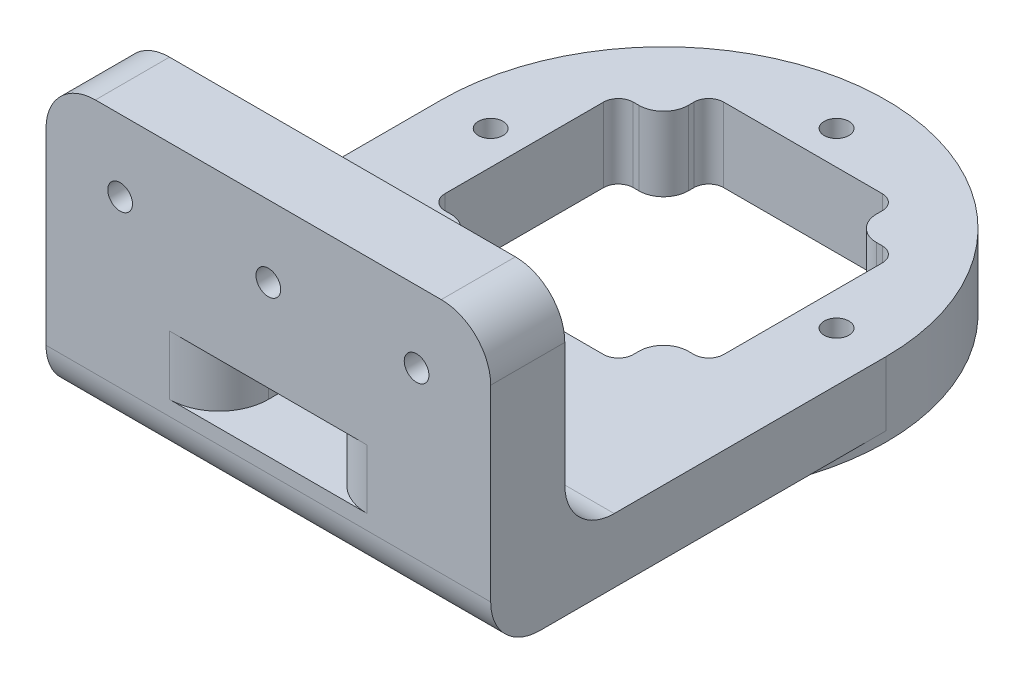
from build123d import *

# Parameters (mm, degrees)
BOSS_EXTRUDE1_DEPTH     = 15
SKETCH2_W               = 90
SKETCH2_H               = 15
BOSS_EXTRUDE2_DEPTH     = 45
CUT_EXTRUDE1_DEPTH      = 2
SKETCH4_R               = 2.5
CUT_EXTRUDE2_DEPTH      = 110.658560997
FILLET1_R               = 10
SKETCH5_R               = 2.5
CUT_EXTRUDE3_DEPTH      = 134.135269557
CUT_EXTRUDE4_DEPTH      = 103.225241501
CUT_EXTRUDE5_DEPTH      = 4
CUT_EXTRUDE6_DEPTH      = 10
CUT_EXTRUDE6_DEPTH_BACK = 15
SKETCH8_W               = 20
SKETCH8_H               = 12
FILLET2_R               = 10


with BuildPart() as part:
    # Sketch1 → Boss-Extrude1 (new body)
    with BuildSketch(Plane(origin=(0, 0, 0), x_dir=(1, 0, 0), z_dir=(0, 1, 0))):
        with BuildLine():
            ThreePointArc((45, 0), (0, -45), (-45, 0))
            Line((-45, 0), (-45, -80))
            Line((-45, -80), (45, -80))
            Line((45, -80), (45, 0))
        make_face()
        with BuildLine():
            Line((-28.2, -16.05), (-28.2, 0))
            Line((-28.2, 0), (-45, 0))
            ThreePointArc((-45, 0), (0, -45), (45, 0))
            Line((45, 0), (28.2, 0))
            Line((28.2, 0), (28.2, -16.05))
            ThreePointArc((28.2, -16.05), (27.321320344, -18.171320344), (25.2, -19.05))
            Line((25.2, -19.05), (24.05, -19.05))
            ThreePointArc((24.05, -19.05), (20.514466094, -20.514466094), (19.05, -24.05))
            Line((19.05, -24.05), (19.05, -25.2))
            ThreePointArc((19.05, -25.2), (18.171320344, -27.321320344), (16.05, -28.2))
            Line((16.05, -28.2), (-16.05, -28.2))
            ThreePointArc((-16.05, -28.2), (-18.171320344, -27.321320344), (-19.05, -25.2))
            Line((-19.05, -25.2), (-19.05, -24.05))
            ThreePointArc((-19.05, -24.05), (-20.514466094, -20.514466094), (-24.05, -19.05))
            Line((-24.05, -19.05), (-25.2, -19.05))
            ThreePointArc((-25.2, -19.05), (-27.321320344, -18.171320344), (-28.2, -16.05))
        make_face()
        with BuildLine():
            ThreePointArc((-19.05, 25.2), (-18.171320344, 27.321320344), (-16.05, 28.2))
            Line((-16.05, 28.2), (16.05, 28.2))
            ThreePointArc((16.05, 28.2), (18.171320344, 27.321320344), (19.05, 25.2))
            Line((19.05, 25.2), (19.05, 24.05))
            ThreePointArc((19.05, 24.05), (20.514466094, 20.514466094), (24.05, 19.05))
            Line((24.05, 19.05), (25.2, 19.05))
            ThreePointArc((25.2, 19.05), (27.321320344, 18.171320344), (28.2, 16.05))
            Line((28.2, 16.05), (28.2, 0))
            Line((28.2, 0), (45, 0))
            ThreePointArc((45, 0), (0, 45), (-45, 0))
            Line((-45, 0), (-28.2, 0))
            Line((-28.2, 0), (-28.2, 16.05))
            ThreePointArc((-28.2, 16.05), (-27.321320344, 18.171320344), (-25.2, 19.05))
            Line((-25.2, 19.05), (-24.05, 19.05))
            ThreePointArc((-24.05, 19.05), (-20.514466094, 20.514466094), (-19.05, 24.05))
            Line((-19.05, 24.05), (-19.05, 25.2))
        make_face()
    extrude(amount=BOSS_EXTRUDE1_DEPTH)

    # Sketch2 → Boss-Extrude2 (add)
    with BuildSketch(Plane(origin=(0, 15, 0), x_dir=(1, 0, 0), z_dir=(0, 1, 0))):
        with Locations((0, -72.5)):
            Rectangle(SKETCH2_W, SKETCH2_H)
    extrude(amount=BOSS_EXTRUDE2_DEPTH)

    # Sketch3 → Cut-Extrude1 (cut)
    with BuildSketch(Plane(origin=(0, 0, 0), x_dir=(-1, 0, 0), z_dir=(0, -1, 0))):
        with BuildLine():
            Line((45, -80), (-45, -80))
            Line((-45, -80), (-45, 0))
            ThreePointArc((-45, 0), (0, -45), (45, 0))
            Line((45, 0), (45, -80))
        make_face()
    extrude(amount=-CUT_EXTRUDE1_DEPTH, mode=Mode.SUBTRACT)

    # Sketch4 → Cut-Extrude2 (cut, through all)
    with BuildSketch(Plane(origin=(0, 0, 0), x_dir=(-1, 0, 0), z_dir=(0, -1, 0))):
        with Locations(Location((0, -35, 0), (0, 0, 90))):
            Circle(SKETCH4_R)
        with Locations(Location((-35, 0, 0), (0, 0, 90))):
            Circle(SKETCH4_R)
        with Locations(Location((0, 35, 0), (0, 0, 90))):
            Circle(SKETCH4_R)
        with Locations(Location((35, 0, 0), (0, 0, 90))):
            Circle(SKETCH4_R)
    extrude(amount=-CUT_EXTRUDE2_DEPTH, mode=Mode.SUBTRACT)

    # Fillet1
    fillet1_edges = [part.edges().sort_by_distance(p)[0] for p in [
        (0, 2, 80),
        (-45, 60, 72.5),
        (45, 60, 72.5),
        (0, 15, 65),
    ]]
    fillet(fillet1_edges, radius=FILLET1_R)

    # Sketch5 → Cut-Extrude3 (cut, through all)
    with BuildSketch(Plane(origin=(0, 0, 65), x_dir=(-1, 0, 0), z_dir=(0, 0, -1))):
        with Locations((-30, 45.502937017)):
            Circle(SKETCH5_R)
        with Locations((30, 45.502937017)):
            Circle(SKETCH5_R)
        with Locations((0, 45.502937017)):
            Circle(SKETCH5_R)
    extrude(amount=-CUT_EXTRUDE3_DEPTH, mode=Mode.SUBTRACT)

    # Sketch6 → Cut-Extrude4 (cut, through all)
    with BuildSketch(Plane(origin=(0, 15, 0), x_dir=(1, 0, 0), z_dir=(0, 1, 0))):
        with BuildLine():
            Line((-15, -47.5), (15, -47.5))
            ThreePointArc((15, -47.5), (17.5, -50), (15, -52.5))
            Line((15, -52.5), (-15, -52.5))
            ThreePointArc((-15, -52.5), (-17.5, -50), (-15, -47.5))
        make_face()
    extrude(amount=-CUT_EXTRUDE4_DEPTH, mode=Mode.SUBTRACT)

    # Sketch7 → Cut-Extrude5 (cut)
    with BuildSketch(Plane.XZ.offset(-2)):
        with BuildLine():
            Line((-15, 54), (15, 54))
            ThreePointArc((15, 54), (19, 50), (15, 46))
            Line((15, 46), (-15, 46))
            ThreePointArc((-15, 46), (-19, 50), (-15, 54))
        make_face()
    extrude(amount=-CUT_EXTRUDE5_DEPTH, mode=Mode.SUBTRACT)

    # Sketch8 → Cut-Extrude6 (cut, two sides: drawn at the far end of the back side and taken through both)
    with BuildSketch(Plane(origin=(0, 0, 65), x_dir=(-1, 0, 0), z_dir=(0, 0, -1)).offset(-CUT_EXTRUDE6_DEPTH_BACK)):
        with Locations((0, 21)):
            Rectangle(SKETCH8_W, SKETCH8_H)
    extrude(amount=CUT_EXTRUDE6_DEPTH + CUT_EXTRUDE6_DEPTH_BACK, mode=Mode.SUBTRACT)

    # Fillet2
    fillet2_edges = [part.edges().sort_by_distance(p)[0] for p in [
        (10, 21, 80),
        (-10, 21, 80),
    ]]
    fillet(fillet2_edges, radius=FILLET2_R)


solid = part.part
